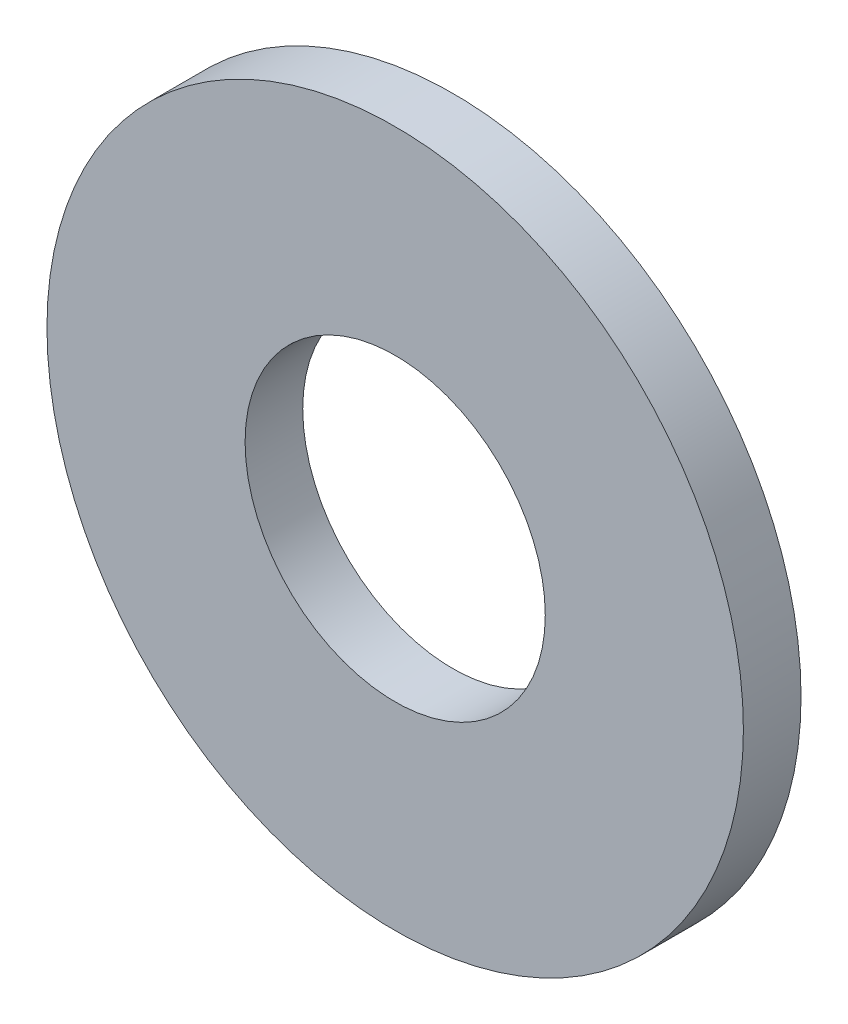
from build123d import *

# Parameters (mm, degrees)
SKETCH_1_R      = 14.5
SKETCH_1_R_2    = 6.25
EXTRUDE_1_DEPTH = 2.4


with BuildPart() as part:
    # Эскиз1 → Бобышка-Вытянуть1 (new body)
    with BuildSketch(Plane.XY):
        Circle(SKETCH_1_R)
        Circle(SKETCH_1_R_2, mode=Mode.SUBTRACT)
    extrude(amount=EXTRUDE_1_DEPTH)


solid = part.part
